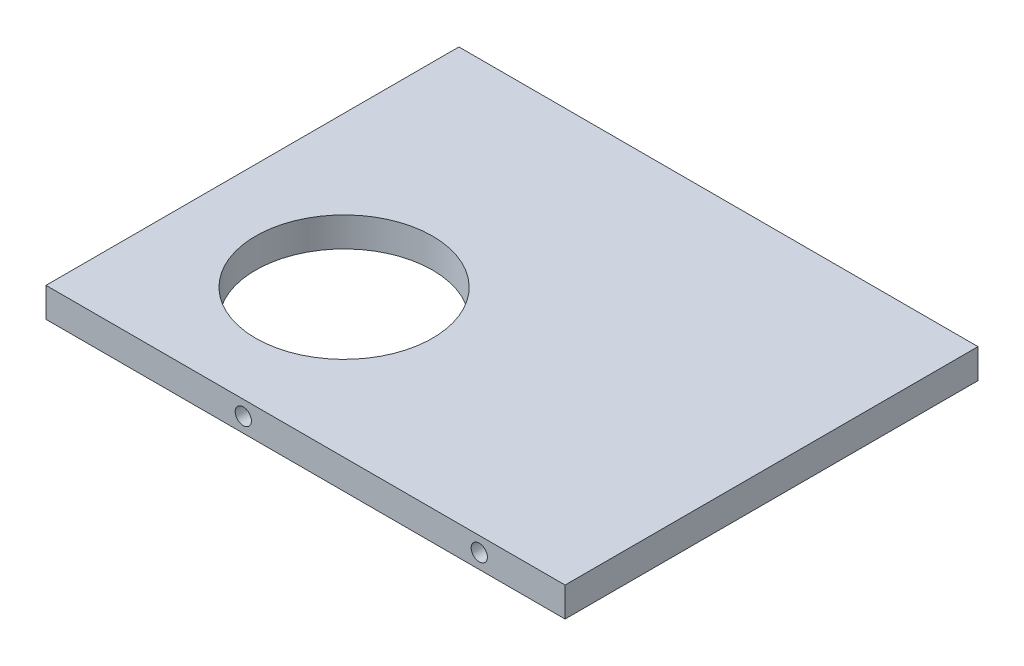
from build123d import *

# Parameters (mm, degrees)
SKETCH1_W           = 88
SKETCH1_H           = 70
BOSS_EXTRUDE1_DEPTH = 5
SKETCH2_R           = 1.375
CUT_EXTRUDE1_DEPTH  = 5
CUT_EXTRUDE2_START  = -5
SKETCH4_R           = 1.375
CUT_EXTRUDE2_DEPTH  = 5
SKETCH5_R           = 15
CUT_EXTRUDE3_DEPTH  = 57.444663167


with BuildPart() as part:
    # Sketch1 → Boss-Extrude1 (new body)
    with BuildSketch(Plane(origin=(0, 0, 0), x_dir=(1, 0, 0), z_dir=(0, 1, 0))):
        Rectangle(SKETCH1_W, SKETCH1_H)
    extrude(amount=BOSS_EXTRUDE1_DEPTH)

    # Sketch2 → Cut-Extrude1 (cut)
    with BuildSketch(Plane.XY.offset(35)):
        with Locations((-10.55, 2.5)):
            Circle(SKETCH2_R)
        with Locations((29.45, 2.5)):
            Circle(SKETCH2_R)
    extrude(amount=-CUT_EXTRUDE1_DEPTH, mode=Mode.SUBTRACT)

    # Sketch4 → Cut-Extrude2 (cut)
    with BuildSketch(Plane(origin=(0, 0, -35), x_dir=(-1, 0, 0), z_dir=(0, 0, -1)).offset(CUT_EXTRUDE2_START)):
        with Locations(Location((-29.45, 2.5, 0), (0, 0, 180))):
            Circle(SKETCH4_R)
        with Locations(Location((10.55, 2.5, 0), (0, 0, 180))):
            Circle(SKETCH4_R)
    extrude(amount=CUT_EXTRUDE2_DEPTH, mode=Mode.SUBTRACT)

    # Sketch5 → Cut-Extrude3 (cut, through all)
    with BuildSketch(Plane(origin=(0, 5, 0), x_dir=(1, 0, 0), z_dir=(0, 1, 0))):
        with Locations(Location((-18.469657797, -10, 0), (0, 0, 270))):
            Circle(SKETCH5_R)
    extrude(amount=-CUT_EXTRUDE3_DEPTH, mode=Mode.SUBTRACT)


solid = part.part
